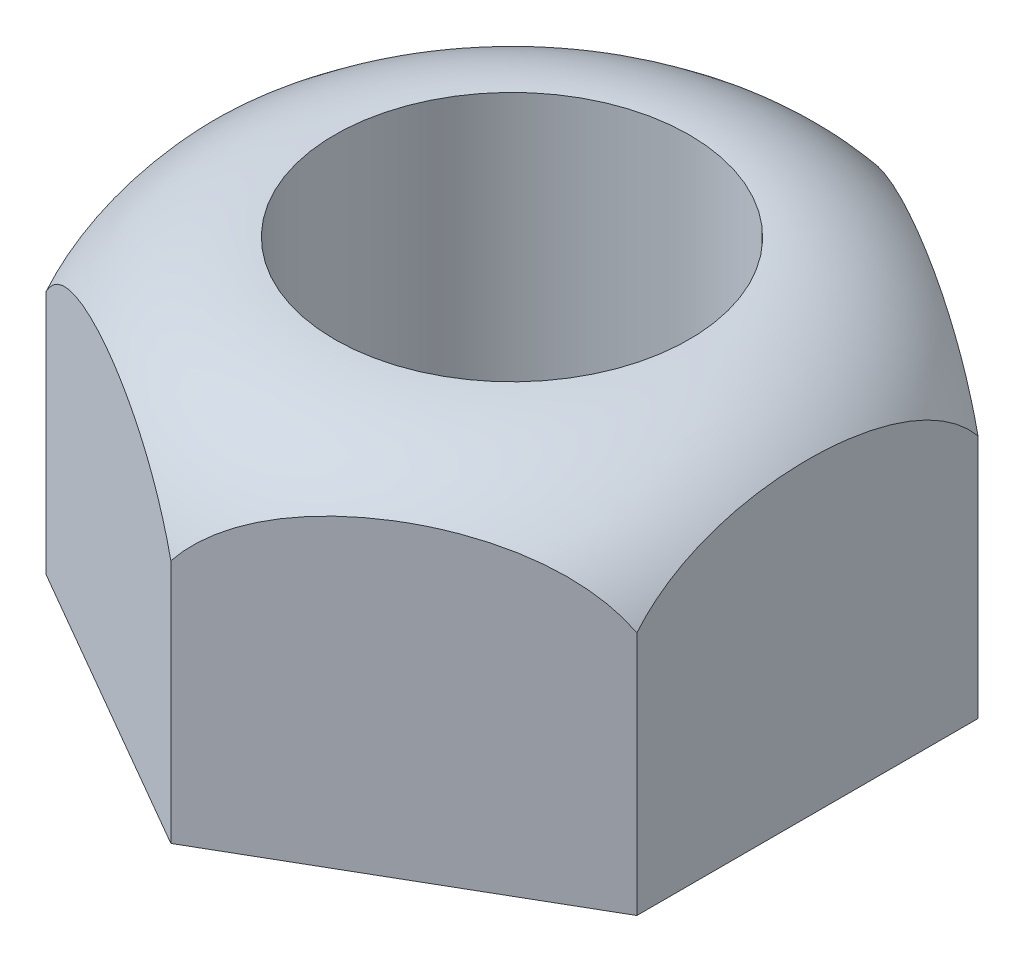
from build123d import *

# Parameters (mm, degrees)
SKETCH3_R           = 3
BOSS_EXTRUDE1_DEPTH = 3


with BuildPart() as part:
    # Sketch3 → Boss-Extrude1 (new, symmetric)
    with BuildSketch(Plane(origin=(0, 0, 0), x_dir=(1, 0, 0), z_dir=(0, 1, 0))):
        Polygon((5, 2.886751346), (0, 5.773502692), (-5, 2.886751346), (-5, -2.886751346), (0, -5.773502692), (5, -2.886751346), align=None)
        with Locations(Location((0, 0, 0), (0, 0, 270))):
            Circle(SKETCH3_R, mode=Mode.SUBTRACT)
    extrude(amount=BOSS_EXTRUDE1_DEPTH, both=True)

    # Sketch5 → Cut-Revolve1 (revolve, cut)
    with BuildSketch(Plane(origin=(0, 0, 0), x_dir=(0, 0, -1), z_dir=(1, 0, 0))):
        with BuildLine():
            Line((3, 3), (5.773502692, 3))
            Line((5.773502692, 3), (5.773502692, 1.143539601))
            ThreePointArc((5.773502692, 1.143539601), (4.668739224, 2.493052226), (3, 3))
        make_face()
    revolve(axis=Axis((0, 0, 0), (0, 1, 0)), mode=Mode.SUBTRACT)


solid = part.part
